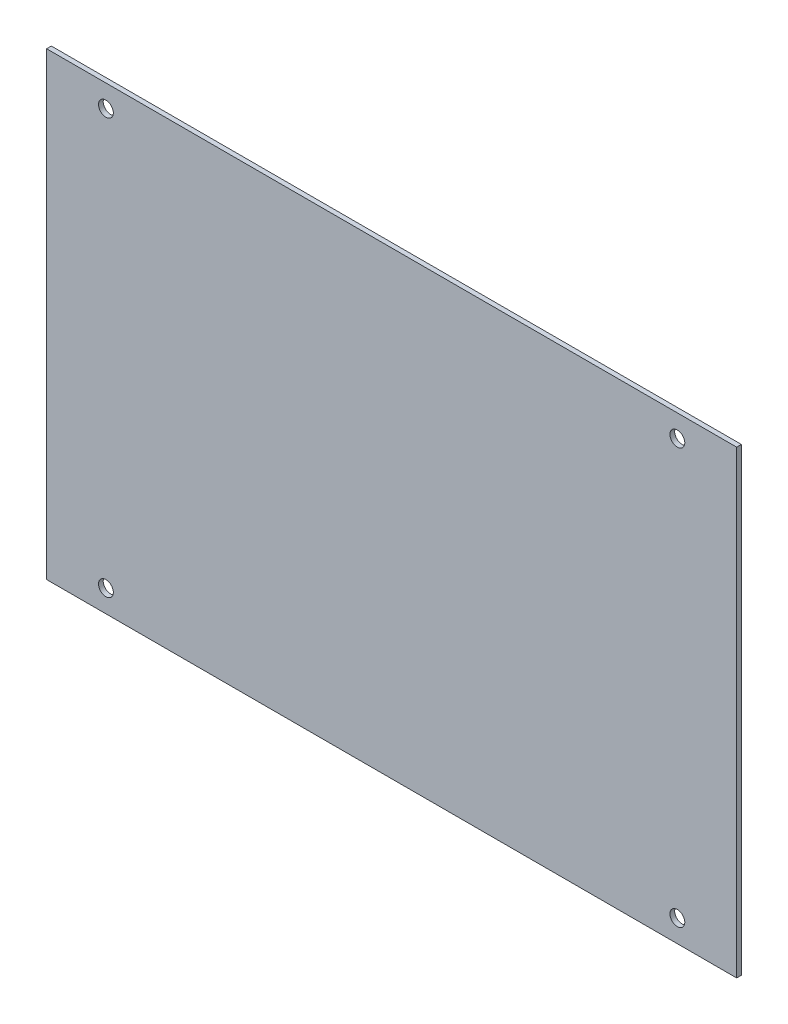
from build123d import *

# Parameters (mm, degrees)
SKETCH1_W           = 232.6676516
SKETCH1_H           = 155
BOSS_EXTRUDE1_DEPTH = 1.5875
SKETCH6_R           = 2.5
CUT_EXTRUDE1_DEPTH  = 204.242095442


with BuildPart() as part:
    # Sketch1 → Boss-Extrude1 (new body)
    with BuildSketch(Plane.XY):
        with Locations((33.576399593, -59.72883635)):
            Rectangle(SKETCH1_W, SKETCH1_H)
    extrude(amount=BOSS_EXTRUDE1_DEPTH)

    # Sketch6 → Cut-Extrude1 (cut, through all)
    with BuildSketch(Plane.XY.offset(1.5875)):
        with Locations((-62.757426207, 10.27116365)):
            Circle(SKETCH6_R)
        with Locations((129.910225393, 10.27116365)):
            Circle(SKETCH6_R)
        with Locations((-62.757426207, -129.72883635)):
            Circle(SKETCH6_R)
        with Locations((129.910225393, -129.72883635)):
            Circle(SKETCH6_R)
    extrude(amount=-CUT_EXTRUDE1_DEPTH, mode=Mode.SUBTRACT)


solid = part.part
